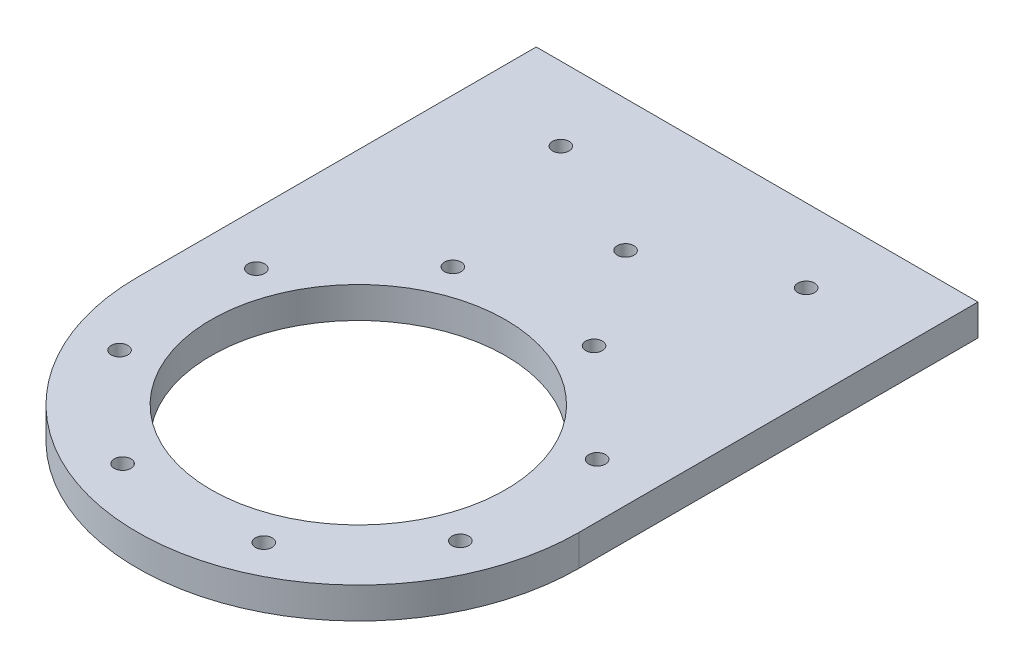
from build123d import *

# Parameters (mm, degrees)
PARED_A_MOTOR_J2_START           = 67.85
CROQUIS1_W                       = 90
CROQUIS1_H                       = 81.25
PARED_A_MOTOR_J2_DEPTH           = 6.35
PARED_A_MOTOR_J2_REDONDEO_START  = 67.85
CROQUIS2_R                       = 45
PARED_A_MOTOR_J2_REDONDEO_DEPTH  = 6.35
ROSCA_M3_ESCUADRAS_START         = 67.85
CROQUIS4_R                       = 1.25
ROSCA_M3_ESCUADRAS_DEPTH         = 6.35
PASADORES_D4_START               = 90.2
CROQUIS5_R                       = 2
PASADORES_D4_DEPTH               = 8
ROSCA_M3_BASES_CINCHO_START      = 67.85
CROQUIS6_R                       = 1.25
ROSCA_M3_BASES_CINCHO_DEPTH      = 6.35
PASO_DRIVER_Y_8XM3_START         = 67.85
CROQUIS7_R                       = 30
CROQUIS7_R_2                     = 1.7
PASO_DRIVER_Y_8XM3_DEPTH         = 6.35
PASO_M3_ESCUADRAS_TUERCA_START   = 67.85
CROQUIS8_R                       = 1.7
PASO_M3_ESCUADRAS_TUERCA_DEPTH   = 6.35
PASO_M3_BASE_CINCHO_TUERCA_START = 67.85
CROQUIS9_R                       = 1.7
PASO_M3_BASE_CINCHO_TUERCA_DEPTH = 6.35


with BuildPart() as part:
    # Croquis1 → Pared_A_motor_J2 (new body)
    with BuildSketch(Plane(origin=(0, 0, 0), x_dir=(1, 0, 0), z_dir=(0, 1, 0)).offset(PARED_A_MOTOR_J2_START)):
        with Locations((0, -130.825)):
            Rectangle(CROQUIS1_W, CROQUIS1_H)
    extrude(amount=PARED_A_MOTOR_J2_DEPTH)

    # Croquis2 → Pared_A_motor_J2_redondeo (add)
    with BuildSketch(Plane(origin=(0, 0, 0), x_dir=(1, 0, 0), z_dir=(0, 1, 0)).offset(PARED_A_MOTOR_J2_REDONDEO_START)):
        with Locations((0, -171.45)):
            Circle(CROQUIS2_R)
    extrude(amount=PARED_A_MOTOR_J2_REDONDEO_DEPTH)

    # Croquis4 → Rosca_M3_escuadras (cut)
    with BuildSketch(Plane(origin=(0, 0, 0), x_dir=(1, 0, 0), z_dir=(0, 1, 0)).offset(ROSCA_M3_ESCUADRAS_START)):
        with Locations(Location((-25, -105.2, 0), (0, 0, 90))):
            Circle(CROQUIS4_R)
        with Locations(Location((25, -105.2, 0), (0, 0, 90))):
            Circle(CROQUIS4_R)
    extrude(amount=ROSCA_M3_ESCUADRAS_DEPTH, mode=Mode.SUBTRACT)

    # Croquis5 → Pasadores_D4 (cut)
    with BuildSketch(Plane.XY.offset(PASADORES_D4_START)):
        with Locations((-38, 71.025)):
            Circle(CROQUIS5_R)
        with Locations((38, 71.025)):
            Circle(CROQUIS5_R)
    extrude(amount=PASADORES_D4_DEPTH, mode=Mode.SUBTRACT)

    # Croquis6 → Rosca_M3_bases_cincho (cut)
    with BuildSketch(Plane(origin=(0, 0, 0), x_dir=(1, 0, 0), z_dir=(0, 1, 0)).offset(ROSCA_M3_BASES_CINCHO_START)):
        with Locations(Location((0, -117, 0), (0, 0, 90))):
            Circle(CROQUIS6_R)
    extrude(amount=ROSCA_M3_BASES_CINCHO_DEPTH, mode=Mode.SUBTRACT)

    # Croquis7 → Paso_driver_y_8xM3 (cut)
    with BuildSketch(Plane(origin=(0, 0, 0), x_dir=(1, 0, 0), z_dir=(0, 1, 0)).offset(PASO_DRIVER_Y_8XM3_START)):
        with Locations(Location((0, -171.45, 0), (0, 0, 90))):
            Circle(CROQUIS7_R)
        with Locations(Location((34.401729978, -185.070608449, 0), (0, 0, 90))):
            Circle(CROQUIS7_R_2)
        with Locations(Location((14.694471953, -205.40692115, 0), (0, 0, 90))):
            Circle(CROQUIS7_R_2)
        with Locations(Location((-13.620608449, -205.851729978, 0), (0, 0, 90))):
            Circle(CROQUIS7_R_2)
        with Locations(Location((-33.95692115, -186.144471953, 0), (0, 0, 90))):
            Circle(CROQUIS7_R_2)
        with Locations(Location((-34.401729978, -157.829391551, 0), (0, 0, 90))):
            Circle(CROQUIS7_R_2)
        with Locations(Location((-14.694471953, -137.49307885, 0), (0, 0, 90))):
            Circle(CROQUIS7_R_2)
        with Locations(Location((13.620608449, -137.048270022, 0), (0, 0, 90))):
            Circle(CROQUIS7_R_2)
        with Locations(Location((33.95692115, -156.755528047, 0), (0, 0, 90))):
            Circle(CROQUIS7_R_2)
    extrude(amount=PASO_DRIVER_Y_8XM3_DEPTH, mode=Mode.SUBTRACT)

    # Croquis8 → Paso_M3_escuadras_tuerca (cut)
    with BuildSketch(Plane(origin=(0, 0, 0), x_dir=(1, 0, 0), z_dir=(0, 1, 0)).offset(PASO_M3_ESCUADRAS_TUERCA_START)):
        with Locations(Location((-25, -105.2, 0), (0, 0, 90))):
            Circle(CROQUIS8_R)
        with Locations(Location((25, -105.2, 0), (0, 0, 90))):
            Circle(CROQUIS8_R)
    extrude(amount=PASO_M3_ESCUADRAS_TUERCA_DEPTH, mode=Mode.SUBTRACT)

    # Croquis9 → Paso_M3_base_cincho_tuerca (cut)
    with BuildSketch(Plane(origin=(0, 0, 0), x_dir=(1, 0, 0), z_dir=(0, 1, 0)).offset(PASO_M3_BASE_CINCHO_TUERCA_START)):
        with Locations(Location((0, -117, 0), (0, 0, 90))):
            Circle(CROQUIS9_R)
    extrude(amount=PASO_M3_BASE_CINCHO_TUERCA_DEPTH, mode=Mode.SUBTRACT)


solid = part.part
